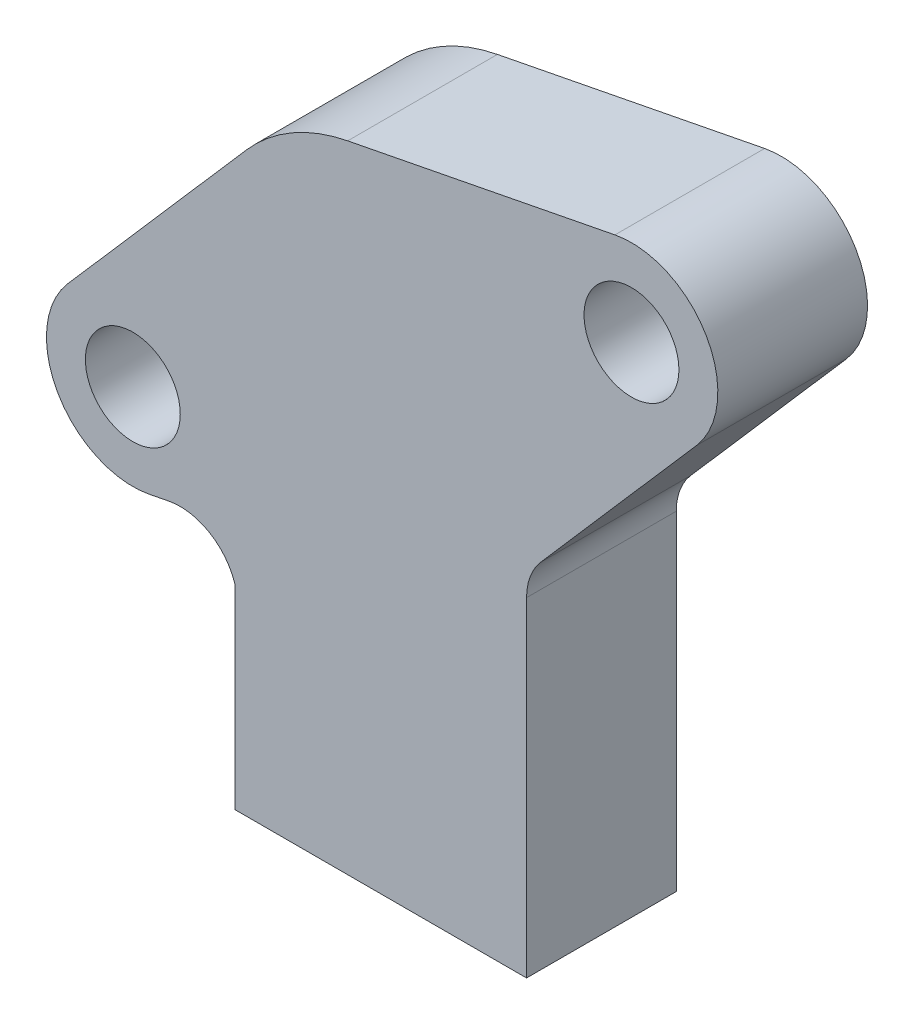
from build123d import *

# Parameters (mm, degrees)
SKETCH1_R               = 2.6162
BOSS_EXTRUDE1_DEPTH     = 8.255
BOSS_EXTRUDE2_START     = -8.255
BOSS_EXTRUDE2_DEPTH     = 8.255
CUT_EXTRUDE1_DEPTH      = 48.016961983
CUT_EXTRUDE1_DEPTH_BACK = 1.397
SKETCH3_W               = 8.255
SKETCH3_H               = 6.985
BOSS_EXTRUDE3_DEPTH     = 1.27


with BuildPart() as part:
    # Sketch1 → Boss-Extrude1 (new body)
    with BuildSketch(Plane.XY.offset(2.107322193)):
        with BuildLine():
            Line((-0.976083412, 8.428441548), (0.293916588, 8.428441851))
            Line((0.293916588, 8.428441851), (0.293916229, 9.932994282))
            ThreePointArc((0.293916229, 9.932994282), (-0.000418872, 12.651350758), (-0.869779891, 15.243706156))
            Line((-0.869779891, 15.243706156), (-0.976085093, 15.474629701))
            ThreePointArc((-0.976085093, 15.474629701), (6.540220685, 27.79826422), (15.111028831, 16.183270977))
            Line((15.111028831, 16.183270977), (14.582439814, 14.704895001))
            ThreePointArc((14.582439814, 14.704895001), (14.027755034, 12.598915738), (13.841030203, 10.42913287))
            Line((13.841030203, 10.42913287), (13.84103068, 8.428445081))
            Line((13.84103068, 8.428445081), (15.11103068, 8.428445384))
            Line((15.11103068, 8.428445384), (15.111029589, 13.002746336))
            ThreePointArc((15.111029589, 13.002746336), (15.312546971, 14.115862595), (15.891518981, 15.087679694))
            Line((15.891518981, 15.087679694), (24.488045189, 24.960647863))
            ThreePointArc((24.488045189, 24.960647863), (25.020724695, 30.469297747), (19.983753108, 32.762306303))
            Line((19.983753108, 32.762306303), (5.247640051, 29.885468019))
            ThreePointArc((5.247640051, 29.885468019), (2.188775836, 28.740388475), (-0.332323255, 26.663872928))
            Line((-0.332323255, 26.663872928), (-10.19178942, 15.340439107))
            ThreePointArc((-10.19178942, 15.340439107), (-10.724468925, 9.831789223), (-5.687497339, 7.538780667))
            Line((-5.687497339, 7.538780667), (-4.598119195, 7.751453082))
            ThreePointArc((-4.598119195, 7.751453082), (-2.818463394, 8.257741333), (-0.976083412, 8.428441548))
        make_face()
        with Locations((-6.600023508, 12.213040207)):
            Circle(SKETCH1_R, mode=Mode.SUBTRACT)
        with Locations((20.896279277, 28.088046763)):
            Circle(SKETCH1_R, mode=Mode.SUBTRACT)
    extrude(amount=BOSS_EXTRUDE1_DEPTH)

    # Sketch2 → Boss-Extrude2 (add)
    with BuildSketch(Plane.XY.offset(10.362322193).offset(BOSS_EXTRUDE2_START)):
        with BuildLine():
            Line((0.293916229, 9.932991253), (0.293916588, 8.428441851))
            Line((0.293916588, 8.428441851), (-0.976083412, 8.428441548))
            ThreePointArc((-0.976083412, 8.428441548), (-2.818463394, 8.257741333), (-4.598119195, 7.751453082))
            ThreePointArc((-4.598119195, 7.751453082), (-2.387631267, 7.376407845), (-0.976082746, 5.634441548))
            Line((-0.976082746, 5.634441548), (-0.976080172, -5.160558452))
            Line((-0.976080172, -5.160558452), (15.11103392, -5.160554616))
            Line((15.11103392, -5.160554616), (15.11103068, 8.428445384))
            Line((15.11103068, 8.428445384), (13.84103068, 8.428445081))
            Line((13.84103068, 8.428445081), (13.841030203, 10.42913287))
            ThreePointArc((13.841030203, 10.42913287), (14.027755034, 12.598915738), (14.582439814, 14.704895001))
            Line((14.582439814, 14.704895001), (15.111028831, 16.183270977))
            ThreePointArc((15.111028831, 16.183270977), (6.540220685, 27.79826422), (-0.976085093, 15.474629701))
            Line((-0.976085093, 15.474629701), (-0.869779891, 15.243706156))
            ThreePointArc((-0.869779891, 15.243706156), (-0.000418548, 12.651349279), (0.293916229, 9.932991253))
        make_face()
        Polygon((0.293917905, 2.903941851), (0.293916588, 2.979402319), (13.841031997, 2.979402319), (13.841031997, 2.903945081), (13.841033587, -3.763554919), (0.293919495, -3.763558149), align=None, mode=Mode.SUBTRACT)
    extrude(amount=BOSS_EXTRUDE2_DEPTH)

    # Sketch3 → Cut-Extrude1 (cut, two sides: drawn at the far end of the back side and taken through both)
    with BuildSketch(Plane(origin=(1.231e-06, -5.160558219, 0), x_dir=(0.9999999999999716, 2.3845959458266363e-07, 0), z_dir=(2.3845959458266363e-07, -0.9999999999999716, 0)).offset(-CUT_EXTRUDE1_DEPTH_BACK)):
        with Locations((7.067475644, 5.599822193)):
            Rectangle(SKETCH3_W, SKETCH3_H)
    extrude(amount=CUT_EXTRUDE1_DEPTH + CUT_EXTRUDE1_DEPTH_BACK, mode=Mode.SUBTRACT)

    # Sketch4 → Boss-Extrude3 (add)
    with BuildSketch(Plane.XY.offset(10.362322193)):
        Polygon((13.841031997, 2.903945081), (13.841031997, 2.979402319), (0.293916588, 2.979402319), (0.293917905, 2.903941851), (0.293919495, -3.763558149), (13.841033587, -3.763554919), align=None)
    extrude(amount=-BOSS_EXTRUDE3_DEPTH)


solid = part.part
